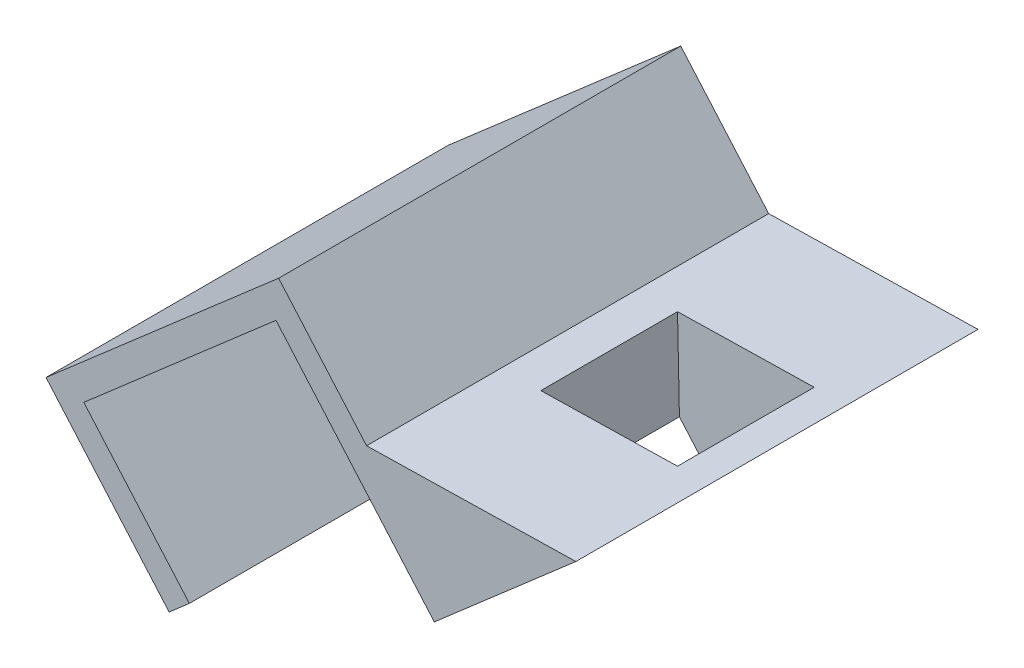
from build123d import *

# Parameters (mm, degrees)
EXTRUDE_THIN1_DEPTH            = 19.05
SKETCH8_W                      = 15.24
SKETCH8_H                      = 38.1
BOSS_EXTRUDE1_DEPTH            = 12.7
CUT_EXTRUDE1_DEPTH             = 83.853768552
CUT_EXTRUDE1_DEPTH_BACK        = 83.853768552
CUT_EXTRUDE2_REACH             = 79.008
SKETCH10_W                     = 12.954
SKETCH10_H                     = 12.954
CUT_EXTRUDE2_DIRECTION_2_DEPTH = 78.007738646


with BuildPart() as part:
    # Sketch1 → Extrude-Thin1 (new, symmetric)
    with BuildSketch(Plane.XY):
        Polygon((-59.25293848, -13.416886184), (-70.919796031, 0), (-48.877768729, 19.166980263), (-32.21082937, 0), (-34.127527396, -1.666693936), (-49.127772819, 15.583588301), (-67.336404069, -0.25000409), (-57.336240454, -11.750192248), align=None)
    extrude(amount=EXTRUDE_THIN1_DEPTH, both=True)

    # Sketch8 → Boss-Extrude1 (add)
    with BuildSketch(Plane(origin=(-13.869033098, 15.949388063, 0), x_dir=(0.7546055221635044, 0.656178714924787, 0), z_dir=(0.656178714924787, -0.7546055221635044, 0))):
        with Locations((-16.686469716, 0)):
            Rectangle(SKETCH8_W, SKETCH8_H)
    extrude(amount=-BOSS_EXTRUDE1_DEPTH)

    # Sketch9 → Cut-Extrude1 (cut, two sides: drawn at the far end of the back side and taken through both)
    with BuildSketch(Plane(origin=(0, 0, -19.05), x_dir=(-1, 0, 0), z_dir=(0, 0, -1)).offset(-CUT_EXTRUDE1_DEPTH_BACK)):
        Polygon((20.710641212, 10.000163615), (40.544299049, 9.583490131), (29.044110892, 19.583653747), align=None)
    extrude(amount=CUT_EXTRUDE1_DEPTH + CUT_EXTRUDE1_DEPTH_BACK, mode=Mode.SUBTRACT)

    # Sketch10 → Cut-Extrude2 (cut, up to next)
    with BuildSketch(Plane(origin=(-0.21913146, 10.430657518, 0), x_dir=(0.9997793965144279, 0.02100376883433655, 0), z_dir=(-0.02100376883433655, 0.9997793965144279, 0)), mode=Mode.PRIVATE) as cut_extrude2_sk1:
        with Locations((-30.047065424, 0.127)):
            Rectangle(SKETCH10_W, SKETCH10_H)
    cut_extrude2_tool1 = extrude(cut_extrude2_sk1.sketch, amount=-CUT_EXTRUDE2_REACH, mode=Mode.PRIVATE) & part.part
    add(cut_extrude2_tool1.solids().sort_by_distance((-30.259568, 9.799556, -0.127))[0], mode=Mode.SUBTRACT)

    # Sketch10 → Cut-Extrude2 direction 2 (cut)
    with BuildSketch(Plane(origin=(-0.21913146, 10.430657518, 0), x_dir=(0.9997793965144279, 0.02100376883433655, 0), z_dir=(-0.02100376883433655, 0.9997793965144279, 0))):
        with Locations((-30.047065424, 0.127)):
            Rectangle(SKETCH10_W, SKETCH10_H)
    extrude(amount=CUT_EXTRUDE2_DIRECTION_2_DEPTH, mode=Mode.SUBTRACT)


solid = part.part
